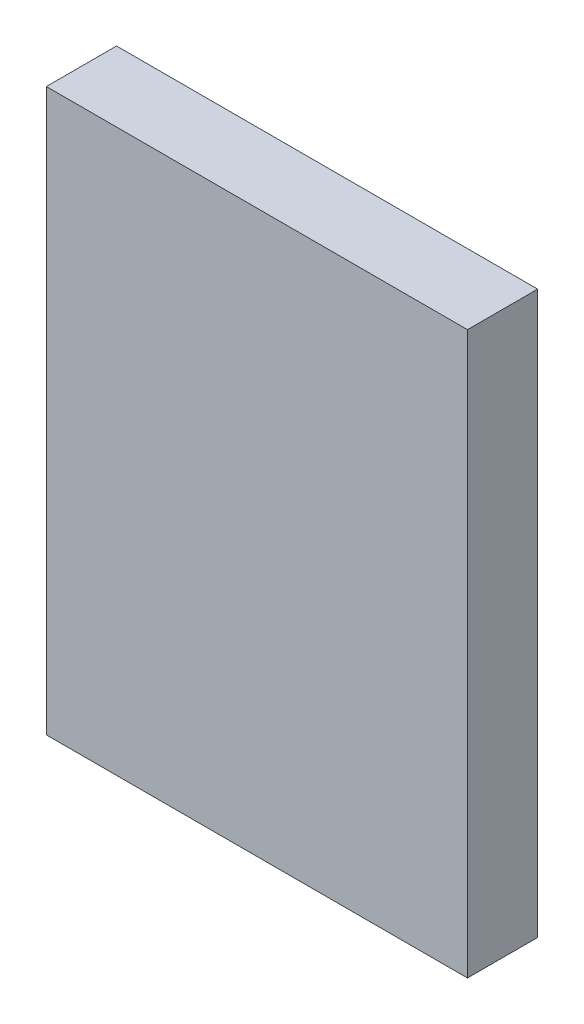
from build123d import *

# Parameters (mm, degrees)
SKETCH1_W           = 30
SKETCH1_H           = 40
BOSS_EXTRUDE1_DEPTH = 5


with BuildPart() as part:
    # Sketch1 → Boss-Extrude1 (new body)
    with BuildSketch(Plane.XY):
        Rectangle(SKETCH1_W, SKETCH1_H)
    extrude(amount=BOSS_EXTRUDE1_DEPTH)


solid = part.part
